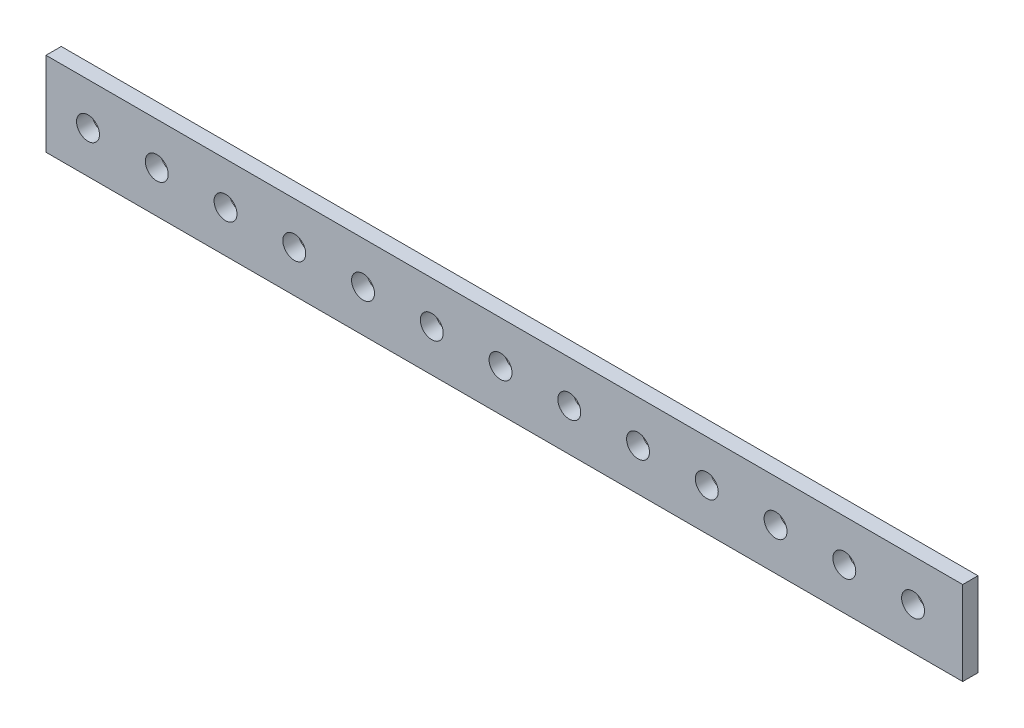
from build123d import *

# Parameters (mm, degrees)
SKETCH1_W           = 1200
SKETCH1_H           = 110
BOSS_EXTRUDE1_DEPTH = 20
SKETCH3_R           = 15
CUT_EXTRUDE1_DEPTH  = 1206.197079319
LPATTERN1_COUNT     = 13
LPATTERN1_PITCH     = 90


with BuildPart() as part:
    # Sketch1 → Boss-Extrude1 (new body)
    with BuildSketch(Plane.XY):
        with Locations((600, 55)):
            Rectangle(SKETCH1_W, SKETCH1_H)
    extrude(amount=BOSS_EXTRUDE1_DEPTH)

    # Sketch3 → Cut-Extrude1 (cut, through all)
    with BuildSketch(Plane.XY.offset(20)):
        with Locations((55, 55)):
            Circle(SKETCH3_R)
    cut_extrude1 = extrude(amount=-CUT_EXTRUDE1_DEPTH, mode=Mode.SUBTRACT)

    # LPattern1: Cut-Extrude1 ×13
    with Locations(*[(i * LPATTERN1_PITCH, 0, 0) for i in range(1, LPATTERN1_COUNT)]):
        add(cut_extrude1, mode=Mode.SUBTRACT)


solid = part.part
